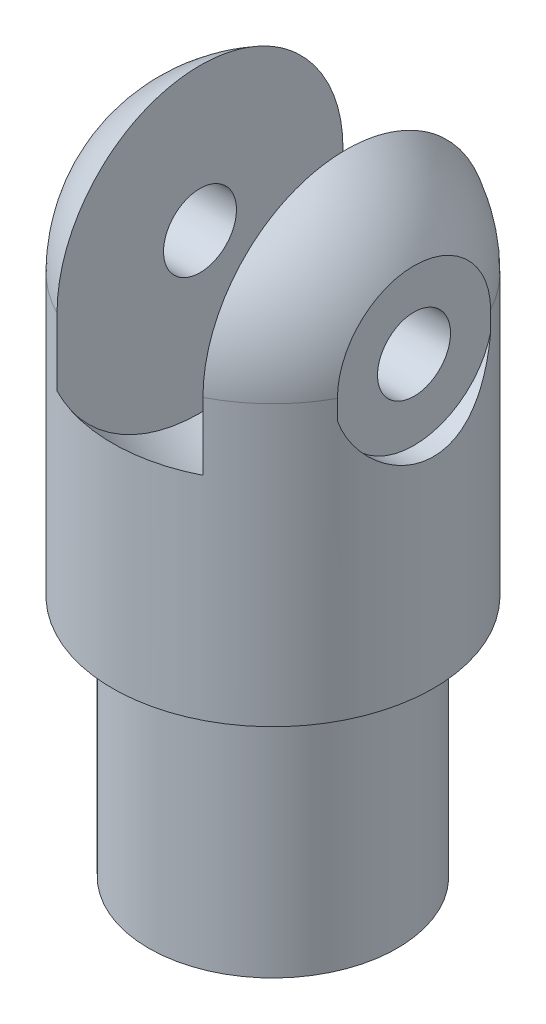
from build123d import *

# Parameters (mm, degrees)
SKETCH1_R               = 12.9794
BOSS_EXTRUDE1_DEPTH     = 25.4
CUT_EXTRUDE1_DEPTH      = 76.208452105
CUT_EXTRUDE1_DEPTH_BACK = 76.208452105
SKETCH3_R               = 3.81
SKETCH6_R               = 8.255
CUT_EXTRUDE2_DEPTH      = 2.032
SKETCH7_R               = 3.81
CUT_EXTRUDE3_DEPTH      = 26.67
SKETCH7_3_R             = 1.905
CUT_EXTRUDE4_DEPTH      = 46.693656372


with BuildPart() as part:
    # Sketch1 → Boss-Extrude1 (new body)
    with BuildSketch(Plane(origin=(0, 0, 0), x_dir=(1, 0, 0), z_dir=(0, 1, 0))):
        Circle(SKETCH1_R)
    extrude(amount=BOSS_EXTRUDE1_DEPTH)

    # Sketch2 → Revolve1 (revolve)
    with BuildSketch(Plane(origin=(0, 0, 0), x_dir=(0, 0, -1), z_dir=(1, 0, 0))):
        with BuildLine():
            Line((-16.764, 25.4), (-16.764, 54.61))
            ThreePointArc((-16.764, 54.61), (-11.85393808, 66.46393808), (0, 71.374))
            Line((0, 71.374), (0, 25.4))
            Line((0, 25.4), (-16.764, 25.4))
        make_face()
    revolve(axis=Axis((0, 25.4, 0), (0, 1, 0)))

    # Sketch3 → Cut-Extrude1 (cut, two sides: drawn at the far end of the back side and taken through both)
    with BuildSketch(Plane(origin=(0, 0, 0), x_dir=(0, 0, -1), z_dir=(1, 0, 0)).offset(-CUT_EXTRUDE1_DEPTH_BACK)):
        with Locations((0, 54.61)):
            Circle(SKETCH3_R)
    extrude(amount=CUT_EXTRUDE1_DEPTH + CUT_EXTRUDE1_DEPTH_BACK, mode=Mode.SUBTRACT)

    # Sketch4 → Cut-Revolve1 (revolve, cut)
    with BuildSketch(Plane.XY):
        with BuildLine():
            Line((-7.62, 38.1), (-7.62, 54.61))
            Line((-7.62, 54.61), (7.62, 54.61))
            Line((7.62, 54.61), (7.62, 38.1))
            ThreePointArc((7.62, 38.1), (0, 36.42636725), (-7.62, 38.1))
        make_face()
    revolve(axis=Axis((-7.62, 54.61, 0), (1, 0, 0)), mode=Mode.SUBTRACT)

    # Sketch6 → Cut-Extrude2 (cut)
    with BuildSketch(Plane(origin=(16.764, 0, 0), x_dir=(0, 0, -1), z_dir=(1, 0, 0))):
        with Locations((0, 54.61)):
            Circle(SKETCH6_R)
    cut_extrude2 = extrude(amount=-CUT_EXTRUDE2_DEPTH, mode=Mode.SUBTRACT)

    # Mirror1: Cut-Extrude2 across plane
    add(cut_extrude2.mirror(Plane(origin=(0, 0, 0), x_dir=(0, 0, 1), z_dir=(1, 0, 0))), mode=Mode.SUBTRACT)

    # Sketch7 → Cut-Extrude3 (cut)
    with BuildSketch(Plane(origin=(0, 30.48, 0), x_dir=(1, 0, 0), z_dir=(0, 1, 0))):
        Circle(SKETCH7_R)
    extrude(amount=CUT_EXTRUDE3_DEPTH, mode=Mode.SUBTRACT)

    # Sketch7<3> → Cut-Extrude4 (cut, through all)
    with BuildSketch(Plane(origin=(0, 30.48, 0), x_dir=(1, 0, 0), z_dir=(0, 1, 0))):
        Circle(SKETCH7_3_R)
    extrude(amount=-CUT_EXTRUDE4_DEPTH, mode=Mode.SUBTRACT)


solid = part.part
